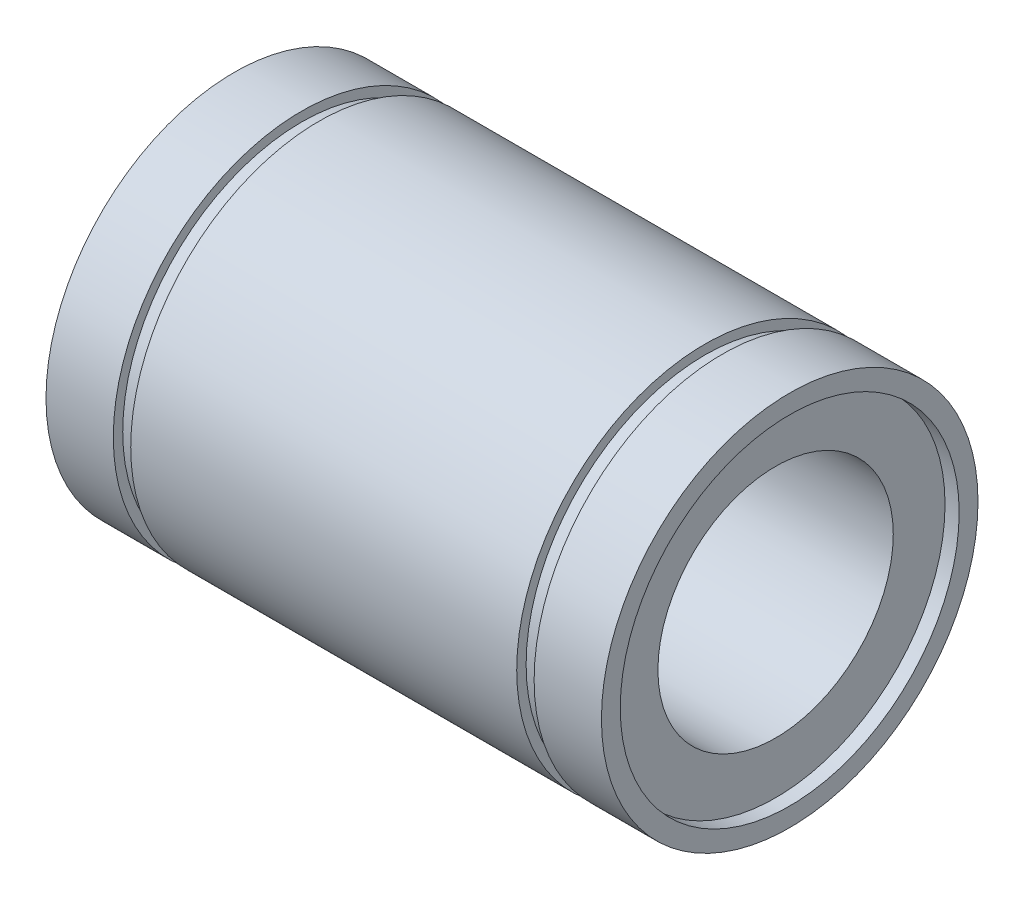
from build123d import *


with BuildPart() as part:
    # Szkic1 → Obrót1 (revolve)
    with BuildSketch(Plane.XY, mode=Mode.PRIVATE) as obr_t1_sk:
        Polygon((20.5, 20), (-20.5, 20), (-20.5, 19), (-22.35, 19), (-22.35, 20), (-29.5, 20), (-29.5, 18), (-28, 18), (-28, 12.5), (28, 12.5), (28, 18), (29.5, 18), (29.5, 20), (22.35, 20), (22.35, 19), (20.5, 19), align=None)
    revolve(obr_t1_sk.sketch.rotate(Axis((-34.370946402, 0, 0), (1, 0, 0)), 90), axis=Axis((-34.370946402, 0, 0), (1, 0, 0)))


solid = part.part
